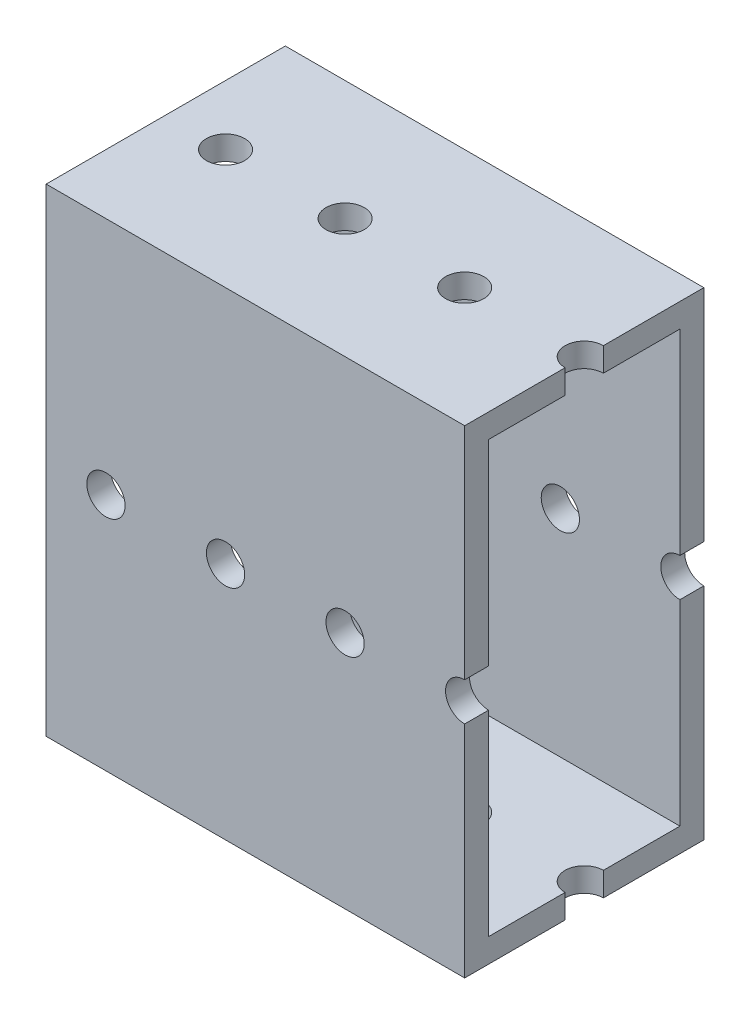
from build123d import *

# Parameters (mm, degrees)
SKETCH1_W           = 25.4
SKETCH1_H           = 50.8
SKETCH1_W_2         = 20.32
SKETCH1_H_2         = 45.72
BOSS_EXTRUDE1_DEPTH = 44.45
SKETCH4_R           = 2.032
CUT_EXTRUDE3_DEPTH  = 69.685751798
SKETCH6_R           = 2.032
CUT_EXTRUDE5_DEPTH  = 58.15


with BuildPart() as part:
    # Sketch1 → Boss-Extrude1 (new body)
    with BuildSketch(Plane(origin=(0, 0, 0), x_dir=(0, 0, -1), z_dir=(1, 0, 0))):
        Rectangle(SKETCH1_W, SKETCH1_H)
        Rectangle(SKETCH1_W_2, SKETCH1_H_2, mode=Mode.SUBTRACT)
    extrude(amount=BOSS_EXTRUDE1_DEPTH)

    # Sketch4 → Cut-Extrude3 (cut, through all)
    with BuildSketch(Plane.XZ.offset(25.4)):
        with Locations(Location((6.35, 0, 0), (0, 0, 270))):
            Circle(SKETCH4_R)
        with Locations(Location((19.05, 0, 0), (0, 0, 270))):
            Circle(SKETCH4_R)
        with Locations(Location((31.75, 0, 0), (0, 0, 270))):
            Circle(SKETCH4_R)
        with Locations((44.45, 0)):
            Circle(SKETCH4_R)
        with Locations((57.15, 0)):
            Circle(SKETCH4_R)
        with Locations((69.85, 0)):
            Circle(SKETCH4_R)
    extrude(amount=-CUT_EXTRUDE3_DEPTH, mode=Mode.SUBTRACT)

    # Sketch6 → Cut-Extrude5 (cut, through all)
    with BuildSketch(Plane(origin=(0, 0, -12.7), x_dir=(-1, 0, 0), z_dir=(0, 0, -1))):
        with Locations((-44.45, 0)):
            Circle(SKETCH6_R)
        with Locations((-31.75, 0)):
            Circle(SKETCH6_R)
        with Locations((-19.05, 0)):
            Circle(SKETCH6_R)
        with Locations((-6.35, 0)):
            Circle(SKETCH6_R)
        with Locations((6.35, 0)):
            Circle(SKETCH6_R)
        with Locations((19.05, 0)):
            Circle(SKETCH6_R)
        with Locations((31.75, 0)):
            Circle(SKETCH6_R)
    extrude(amount=-CUT_EXTRUDE5_DEPTH, mode=Mode.SUBTRACT)


solid = part.part
